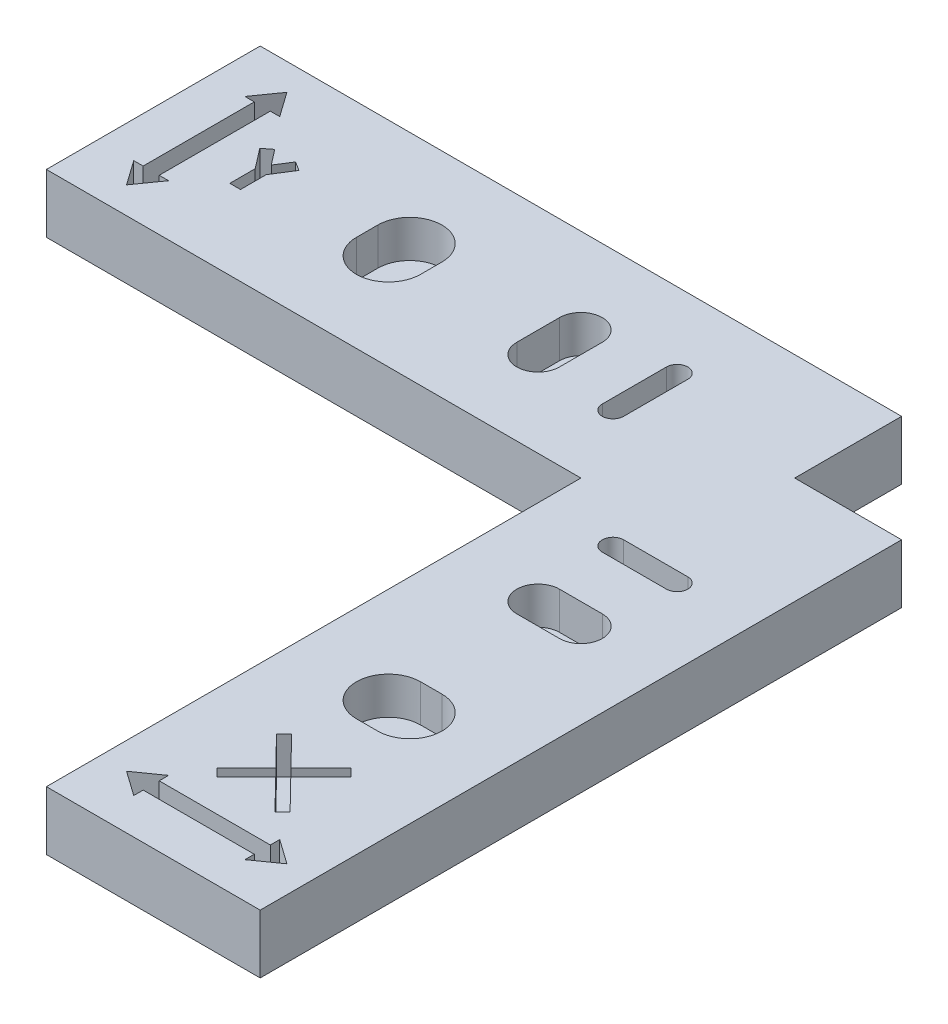
from build123d import *

# Parameters (mm, degrees)
BOSS_EXTRUDE1_DEPTH = 3.5
BOSS_EXTRUDE3_DEPTH = 2


with BuildPart() as part:
    # Sketch1 → Boss-Extrude1 (new body)
    with BuildSketch(Plane(origin=(0, 0, 0), x_dir=(1, 0, 0), z_dir=(0, 1, 0))):
        Polygon((20, 10), (10, 10), (10, 20), (-50, 20), (-50, 0), (0, 0), (0, -50), (20, -50), align=None)
        Polygon((15.197176758, -43.369163918), (17.5, -45), (15.197176758, -46.630836082), (15.197176758, -45.75), (4.802823242, -45.75), (4.802823242, -46.630836082), (2.5, -45), (4.802823242, -43.369163918), (4.802823242, -44.25), (15.197176758, -44.25), align=None, mode=Mode.SUBTRACT)
        Polygon((7.193827961, -41.21727219), (6.840274571, -40.863718799), (6.48672118, -40.510165409), (9.229988375, -37.766898214), (6.482771236, -34.957244322), (6.840274571, -34.607685506), (7.197777905, -34.25812669), (9.93713979, -37.059746799), (12.742754474, -34.254132115), (13.096307864, -34.607685506), (13.449861255, -34.961238896), (10.636301551, -37.7747986), (13.453811199, -40.656342558), (13.096307864, -41.005901374), (12.73880453, -41.35546019), (9.929150136, -38.481950015), align=None, mode=Mode.SUBTRACT)
        with BuildLine():
            Line((9, -24), (11, -24))
            ThreePointArc((11, -24), (14, -27), (11, -30))
            Line((11, -30), (9, -30))
            ThreePointArc((9, -30), (6, -27), (9, -24))
        make_face(mode=Mode.SUBTRACT)
        Polygon((-43.369163918, 4.802823242), (-45, 2.5), (-46.630836082, 4.802823242), (-45.75, 4.802823242), (-45.75, 15.197176758), (-46.630836082, 15.197176758), (-45, 17.5), (-43.369163918, 15.197176758), (-44.25, 15.197176758), (-44.25, 4.802823242), align=None, mode=Mode.SUBTRACT)
        Polygon((-40.942094571, 12.305355363), (-39.836319425, 10.871595985), (-38.954723638, 12.267051774), (-38.10930457, 11.732948226), (-39.295537885, 9.85528936), (-39.295537885, 7.454795226), (-40.295537885, 7.454795226), (-40.295537885, 9.829586897), (-41.733948351, 11.694644637), align=None, mode=Mode.SUBTRACT)
        with BuildLine():
            ThreePointArc((-30, 11), (-27, 14), (-24, 11))
            Line((-24, 11), (-24, 9))
            ThreePointArc((-24, 9), (-27, 6), (-30, 9))
            Line((-30, 9), (-30, 11))
        make_face(mode=Mode.SUBTRACT)
        with BuildLine():
            Line((8, -10), (12, -10))
            ThreePointArc((12, -10), (14, -12), (12, -14))
            Line((12, -14), (8, -14))
            ThreePointArc((8, -14), (6, -12), (8, -10))
        make_face(mode=Mode.SUBTRACT)
        with BuildLine():
            Line((7, -3), (13, -3))
            ThreePointArc((13, -3), (14, -4), (13, -5))
            Line((13, -5), (7, -5))
            ThreePointArc((7, -5), (6, -4), (7, -3))
        make_face(mode=Mode.SUBTRACT)
        with BuildLine():
            ThreePointArc((-14, 12), (-12, 14), (-10, 12))
            Line((-10, 12), (-10, 8))
            ThreePointArc((-10, 8), (-12, 6), (-14, 8))
            Line((-14, 8), (-14, 12))
        make_face(mode=Mode.SUBTRACT)
        with BuildLine():
            ThreePointArc((-5, 13), (-4, 14), (-3, 13))
            Line((-3, 13), (-3, 7))
            ThreePointArc((-3, 7), (-4, 6), (-5, 7))
            Line((-5, 7), (-5, 13))
        make_face(mode=Mode.SUBTRACT)
    extrude(amount=BOSS_EXTRUDE1_DEPTH)

    # Sketch2 → Boss-Extrude3 (add)
    with BuildSketch(Plane.XZ):
        Polygon((20, 50), (0, 50), (0, 0), (-50, 0), (-50, -20), (10, -20), (10, -10), (20, -10), align=None)
    extrude(amount=BOSS_EXTRUDE3_DEPTH)


solid = part.part
